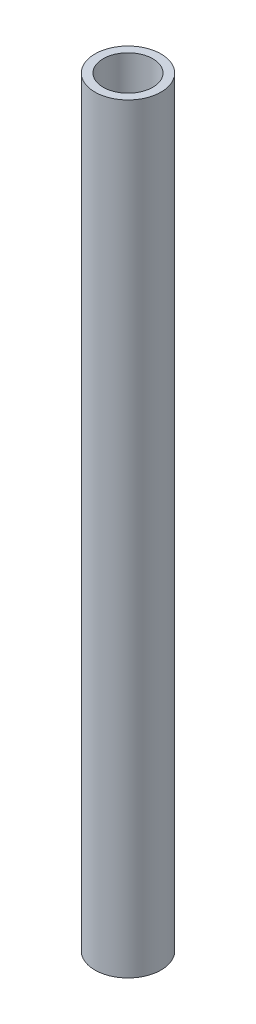
from build123d import *

# Parameters (mm, degrees)
SKETCH1_R           = 12.7
SKETCH1_R_2         = 9.525
BOSS_EXTRUDE1_DEPTH = 292.1


with BuildPart() as part:
    # Sketch1 → Boss-Extrude1 (new body)
    with BuildSketch(Plane(origin=(0, 0, 0), x_dir=(1, 0, 0), z_dir=(0, 1, 0))):
        with Locations(Location((0, 0, 0), (0, 0, 270))):
            Circle(SKETCH1_R)
        with Locations(Location((0, 0, 0), (0, 0, 270))):
            Circle(SKETCH1_R_2, mode=Mode.SUBTRACT)
    extrude(amount=BOSS_EXTRUDE1_DEPTH)


solid = part.part
